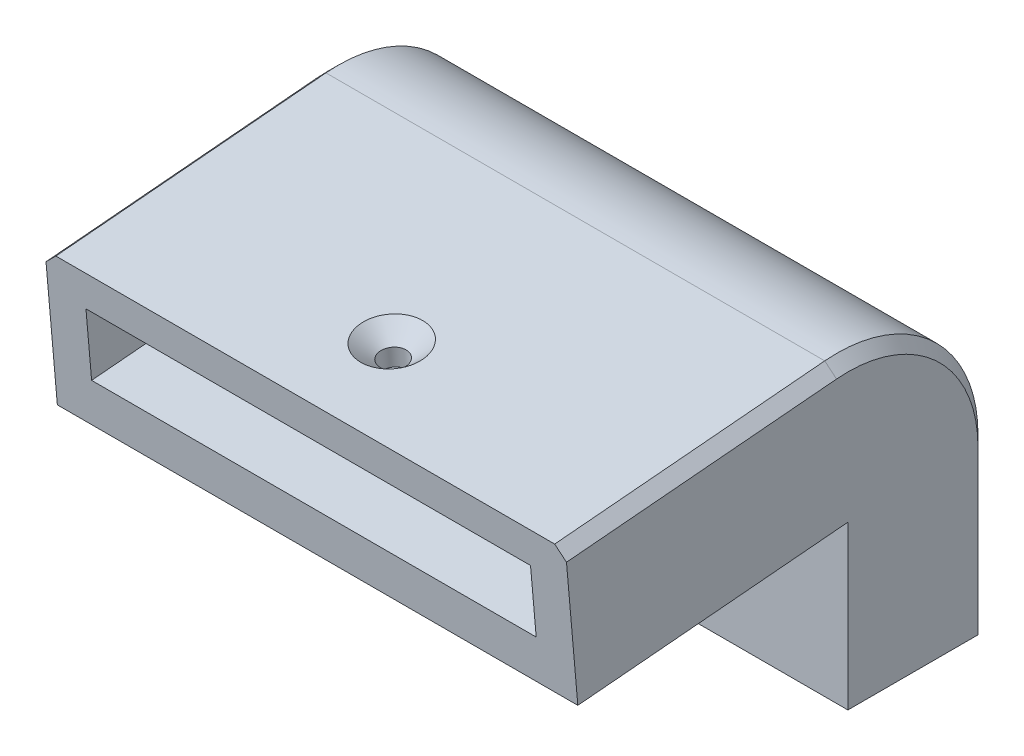
from build123d import *
from OCP.BRepFilletAPI import BRepFilletAPI_MakeChamfer

# Parameters (mm, degrees)
SKETCH1_W           = 60.96
SKETCH1_H           = 16.51
SKETCH1_W_2         = 50.8
SKETCH1_H_2         = 6.35
BOSS_EXTRUDE1_DEPTH = 19.05
BOSS_EXTRUDE2_DEPTH = 60.96
SKETCH7_W           = 50.8
SKETCH7_H           = 6.35
CUT_EXTRUDE1_DEPTH  = 19.05
SKETCH8_R           = 1.524
CUT_EXTRUDE2_DEPTH  = 61.718810561
SKETCH9_R           = 1.593897105
CUT_EXTRUDE3_DEPTH  = 69.202157429
CHAMFER1_SIZE       = 2.1082
CHAMFER1_SIZE2      = 1.832630301
SKETCH10_W          = 52.07
SKETCH10_H          = 7.62
CUT_EXTRUDE4_DEPTH  = 19.05
SKETCH11_W          = 52.07
SKETCH11_H          = 7.62
CUT_EXTRUDE5_DEPTH  = 19.05
CHAMFER2_SIZE       = 1.27


with BuildPart() as part:
    # Sketch1 → Boss-Extrude1 (new body)
    with BuildSketch(Plane(origin=(0, 0, 0), x_dir=(1, 0, 0), z_dir=(0, 1, 0))):
        Rectangle(SKETCH1_W, SKETCH1_H)
        Rectangle(SKETCH1_W_2, SKETCH1_H_2, mode=Mode.SUBTRACT)
    extrude(amount=BOSS_EXTRUDE1_DEPTH)

    # Sketch5 → Boss-Extrude2 (add)
    with BuildSketch(Plane(origin=(30.48, 0, 0), x_dir=(0, 0, -1), z_dir=(1, 0, 0))):
        with BuildLine():
            Line((8.255, 19.05), (-8.255, 19.05))
            Line((-8.255, 19.05), (-39.884181664, 16.282805168))
            Line((-39.884181664, 16.282805168), (-41.323122977, 32.729979633))
            Line((-41.323122977, 32.729979633), (-28.671450311, 33.836857566))
            Line((-28.671450311, 33.836857566), (-9.693941313, 35.497174465))
            ThreePointArc((-9.693941313, 35.497174465), (2.898994328, 31.222448831), (8.255, 19.05))
        make_face()
    extrude(amount=-BOSS_EXTRUDE2_DEPTH)

    # Sketch7 → Cut-Extrude1 (cut)
    with BuildSketch(Plane(origin=(0, -3.339221533, 38.167476773), x_dir=(1, 0, 0), z_dir=(0, -0.08715574274765728, 0.9961946980917457))):
        with Locations((0, 28.449053402)):
            Rectangle(SKETCH7_W, SKETCH7_H)
    extrude(amount=-CUT_EXTRUDE1_DEPTH, mode=Mode.SUBTRACT)

    # Sketch8 → Cut-Extrude2 (cut, through all)
    with BuildSketch(Plane(origin=(0, 36.069201166, 3.155646204), x_dir=(1, 0, 0), z_dir=(0, 0.9961946980917459, 0.08715574274765486))):
        with Locations(Location((0, -28.153270333, 0), (0, 0, 270))):
            Circle(SKETCH8_R)
    extrude(amount=-CUT_EXTRUDE2_DEPTH, mode=Mode.SUBTRACT)

    # Sketch9 → Cut-Extrude3 (cut, through all)
    with BuildSketch(Plane(origin=(0, 0, -8.255), x_dir=(-1, 0, 0), z_dir=(0, 0, -1))):
        with Locations((0, 10.16)):
            Circle(SKETCH9_R)
    extrude(amount=-CUT_EXTRUDE3_DEPTH, mode=Mode.SUBTRACT)

    # Chamfer1: one chamfer whose edges measure the first distance from different faces: ONE call of the kernel's chamfer builder (chamfer() names one face for all edges)
    chamfer1_edges_1 = [part.edges().sort_by_distance(p)[0] for p in [
        (0, 33.748307332, 29.683584125),
    ]]
    chamfer1_side_1 = [part.faces().sort_by_distance(p)[0] for p in [
        (0, 34.115461929, 25.486987868),
    ]]
    chamfer1_edges_2 = [part.edges().sort_by_distance(p)[0] for p in [
        (1.593897105, 10.16, -8.255),
    ]]
    chamfer1_side_2 = [part.faces().sort_by_distance(p)[0] for p in [
        (-29.841327619, 9.525, -8.255),
    ]]
    chamfer1 = BRepFilletAPI_MakeChamfer(part.part.solid().wrapped)
    for e in chamfer1_edges_1:
        chamfer1.Add(CHAMFER1_SIZE, CHAMFER1_SIZE2, e.wrapped, chamfer1_side_1[0].wrapped)  # the first distance lies on this face
    for e in chamfer1_edges_2:
        chamfer1.Add(CHAMFER1_SIZE, CHAMFER1_SIZE2, e.wrapped, chamfer1_side_2[0].wrapped)  # the first distance lies on this face
    add(Compound.cast(chamfer1.Shape()), mode=Mode.REPLACE)

    # Sketch10 → Cut-Extrude4 (cut)
    with BuildSketch(Plane(origin=(0, -3.339221533, 38.167476773), x_dir=(1, 0, 0), z_dir=(0, -0.08715574274765728, 0.9961946980917457))):
        with Locations((0, 28.449053402)):
            Rectangle(SKETCH10_W, SKETCH10_H)
    extrude(amount=-CUT_EXTRUDE4_DEPTH, mode=Mode.SUBTRACT)

    # Sketch11 → Cut-Extrude5 (cut)
    with BuildSketch(Plane.XZ):
        Rectangle(SKETCH11_W, SKETCH11_H)
    extrude(amount=-CUT_EXTRUDE5_DEPTH, mode=Mode.SUBTRACT)

    # Chamfer2
    chamfer2_edges = [part.edges().sort_by_distance(p)[0] for p in [
        (30.48, 31.222448831, -2.898994328),
        (30.48, 34.113577049, 25.508532145),
        (-30.48, 31.222448831, -2.898994328),
        (-30.48, 34.113577049, 25.508532145),
        (-30.48, 9.525, -8.255),
        (30.48, 9.525, -8.255),
    ]]
    chamfer(chamfer2_edges, length=CHAMFER2_SIZE)


solid = part.part
